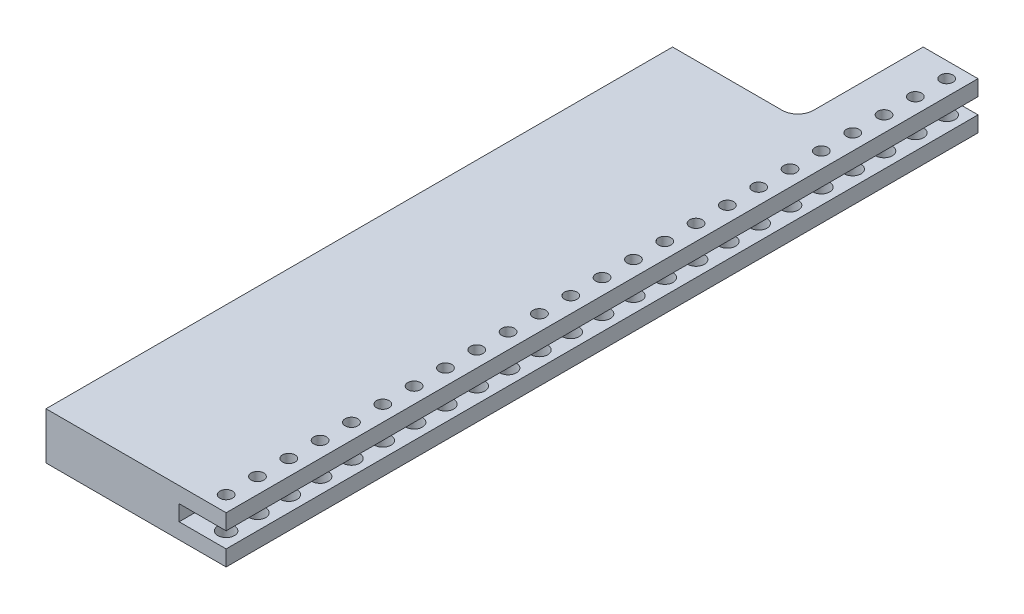
from build123d import *

# Parameters (mm, degrees)
BOSS_EXTRUDE1_DEPTH         = 9.525
CUT_EXTRUDE1_REACH          = 312.187
SKETCH2_W                   = 19.05
SKETCH2_H                   = 6.35
FILLET1_R                   = 6.35
F_1_4_20_TAPPED_HOLE2_D     = 5.1054
F_1_4_20_TAPPED_HOLE2_DEPTH = 6.35
F_1_4_CLEARANCE_HOLE1_D     = 6.7564
F_1_4_CLEARANCE_HOLE1_DEPTH = 6.35
LPATTERN2_COUNT             = 24
LPATTERN2_PITCH             = 12.7


with BuildPart() as part:
    # Sketch1 → Boss-Extrude1 (new, symmetric)
    with BuildSketch(Plane(origin=(0, 0, 0), x_dir=(1, 0, 0), z_dir=(0, 1, 0))):
        Polygon((-56.762661738, -101.318299445), (16.262338262, -101.318299445), (16.262338262, 203.481700555), (-5.962661738, 203.481700555), (-5.962661738, 152.681700555), (-56.762661738, 152.681700555), align=None)
    extrude(amount=BOSS_EXTRUDE1_DEPTH, both=True)

    # Sketch2 → Cut-Extrude1 (cut, up to next)
    with BuildSketch(Plane.XY.offset(101.318299445), mode=Mode.PRIVATE) as cut_extrude1_sk1:
        with Locations((6.737338262, 0)):
            Rectangle(SKETCH2_W, SKETCH2_H)
    cut_extrude1_tool1 = extrude(cut_extrude1_sk1.sketch, amount=-CUT_EXTRUDE1_REACH, mode=Mode.PRIVATE) & part.part
    add(cut_extrude1_tool1.solids().sort_by_distance((6.737338, 0, 101.318299))[0], mode=Mode.SUBTRACT)

    # Fillet1
    fillet1_edges = [part.edges().sort_by_distance(p)[0] for p in [
        (-5.962661738, 0, -152.681700555),
    ]]
    fillet(fillet1_edges, radius=FILLET1_R)

    # 1/4-20 Tapped Hole2
    with Locations(Plane(origin=(0, 9.525, 0), x_dir=(1, 0, 0), z_dir=(0, 1, 0))):
        with Locations((9.912338262, 197.131700555)):
            f_1_4_20_tapped_hole2 = Hole(F_1_4_20_TAPPED_HOLE2_D / 2, depth=F_1_4_20_TAPPED_HOLE2_DEPTH)

    # 1/4 Clearance Hole1
    with Locations(Plane(origin=(0, -3.175, 0), x_dir=(1, 0, 0), z_dir=(0, 1, 0))):
        with Locations((9.912338262, 197.131700555)):
            f_1_4_clearance_hole1 = Hole(F_1_4_CLEARANCE_HOLE1_D / 2, depth=F_1_4_CLEARANCE_HOLE1_DEPTH)

    # LPattern2: 1/4-20 Tapped Hole2, 1/4 Clearance Hole1 ×24
    with Locations(*[(0, 0, i * LPATTERN2_PITCH) for i in range(1, LPATTERN2_COUNT)]):
        add(f_1_4_20_tapped_hole2, mode=Mode.SUBTRACT)
        add(f_1_4_clearance_hole1, mode=Mode.SUBTRACT)


solid = part.part
